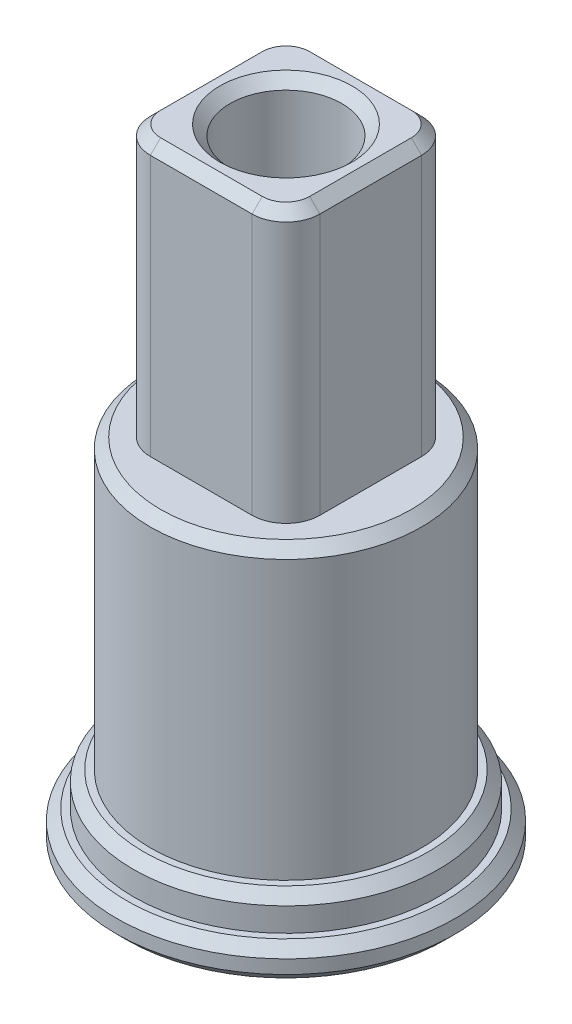
from build123d import *

# Parameters (mm, degrees)
SKETCH_1_R          = 5
SKETCH_1_R_2        = 4.5
EXTRUDE_1_DEPTH     = 1
SKETCH_1_5_R        = 4.5
SKETCH_1_5_R_2      = 4
EXTRUDE_2_DEPTH     = 2
SKETCH_1_6_R        = 4
EXTRUDE_3_DEPTH     = 10.5
SKETCH_1_7_W        = 5
SKETCH_1_7_H        = 5
EXTRUDE_4_DEPTH     = 18.5
CUT_EXTRUDE_1_DEPTH = 1
SKETCH_5_R          = 1.65
CUT_EXTRUDE_2_DEPTH = 10
FILLET_1_R          = 1
CHAMFER_1_SIZE      = 0.3


with BuildPart() as part:
    # 스케치1 → 보스-돌출1 (new body)
    with BuildSketch(Plane(origin=(0, 0, 0), x_dir=(1, 0, 0), z_dir=(0, 1, 0))):
        Circle(SKETCH_1_R)
        Circle(SKETCH_1_R_2, mode=Mode.SUBTRACT)
    extrude(amount=EXTRUDE_1_DEPTH)

    # 스케치1<5> → 보스-돌출2 (add)
    with BuildSketch(Plane(origin=(0, 0, 0), x_dir=(1, 0, 0), z_dir=(0, 1, 0))):
        Circle(SKETCH_1_5_R)
        Circle(SKETCH_1_5_R_2, mode=Mode.SUBTRACT)
    extrude(amount=EXTRUDE_2_DEPTH)

    # 스케치1<6> → 보스-돌출3 (add)
    with BuildSketch(Plane(origin=(0, 0, 0), x_dir=(1, 0, 0), z_dir=(0, 1, 0))):
        Circle(SKETCH_1_6_R)
    extrude(amount=EXTRUDE_3_DEPTH)

    # 스케치1<7> → 보스-돌출4 (add)
    with BuildSketch(Plane(origin=(0, 0, 0), x_dir=(1, 0, 0), z_dir=(0, 1, 0))):
        Rectangle(SKETCH_1_7_W, SKETCH_1_7_H)
    extrude(amount=EXTRUDE_4_DEPTH)

    # 스케치3 → 컷-돌출1 (cut)
    with BuildSketch(Plane.XZ):
        with BuildLine():
            Line((1, 1), (1, -1))
            ThreePointArc((1, -1), (0, -2), (-1, -1))
            Line((-1, -1), (-1, 1))
            ThreePointArc((-1, 1), (0, 2), (1, 1))
        make_face()
    extrude(amount=-CUT_EXTRUDE_1_DEPTH, mode=Mode.SUBTRACT)

    # 스케치4 → 컷-회전1 (revolve, cut)
    with BuildSketch(Plane.XY):
        Polygon((0, 8.5), (-1.65, 8.5), (0, 7.816547622), align=None)
    revolve(axis=Axis((0, -0.586194708, 0), (0, 1, 0)), mode=Mode.SUBTRACT)

    # 스케치5 → 컷-돌출2 (cut)
    with BuildSketch(Plane(origin=(0, 18.5, 0), x_dir=(1, 0, 0), z_dir=(0, 1, 0))):
        Circle(SKETCH_5_R)
    extrude(amount=-CUT_EXTRUDE_2_DEPTH, mode=Mode.SUBTRACT)

    # 필렛1
    fillet_1_edges = [part.edges().sort_by_distance(p)[0] for p in [
        (2.5, 14.5, 2.5),
        (2.5, 14.5, -2.5),
        (-2.5, 14.5, 2.5),
        (-2.5, 14.5, -2.5),
    ]]
    fillet(fillet_1_edges, radius=FILLET_1_R)

    # 모따기1
    chamfer_1_edges = [part.edges().sort_by_distance(p)[0] for p in [
        (-1.65, 18.5, 0),
        (-5, 0, 0),
        (-5, 1, 0),
        (-4.5, 2, 0),
        (-4, 10.5, 0),
        (2.5, 18.5, 0),
        (0, 18.5, -2.5),
        (-2.5, 18.5, 0),
        (0, 18.5, 2.5),
        (2.207106781, 18.5, 2.207106781),
        (-2.207106781, 18.5, 2.207106781),
        (2.207106781, 18.5, -2.207106781),
        (-2.207106781, 18.5, -2.207106781),
    ]]
    chamfer(chamfer_1_edges, length=CHAMFER_1_SIZE)


solid = part.part
